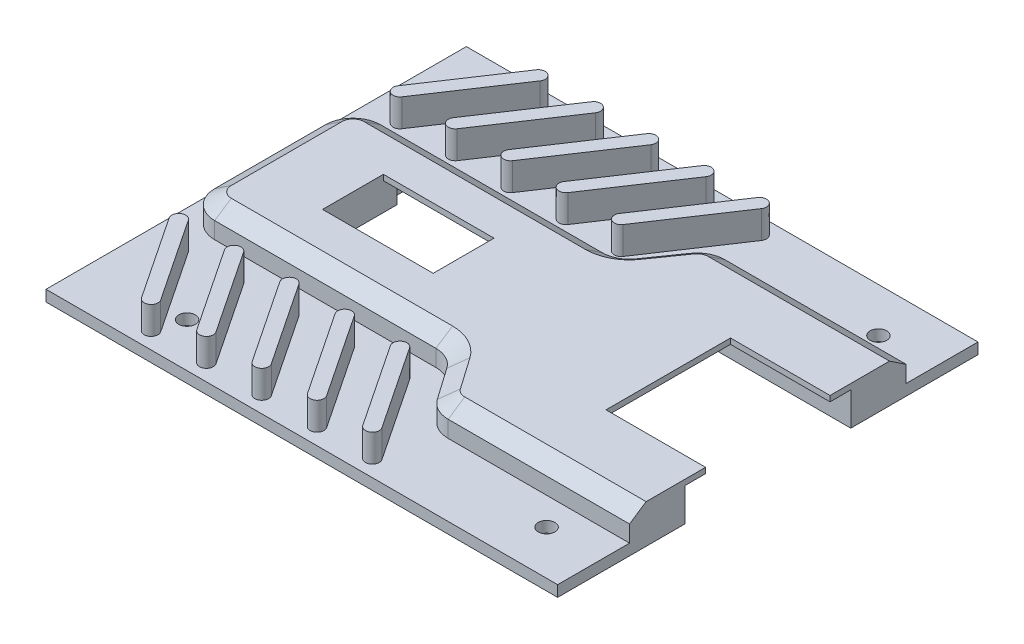
from build123d import *
from OCP.BRepFilletAPI import BRepFilletAPI_MakeChamfer

# Parameters (mm, degrees)
SKETCH1_W           = 190
SKETCH1_H           = 160
BOSS_EXTRUDE1_DEPTH = 4
BOSS_EXTRUDE2_DEPTH = 10
CHAMFER2_SIZE       = 4
CHAMFER2_SIZE2      = 6
SKETCH3_W           = 5
SKETCH3_H           = 152
SKETCH3_H_2         = 4
SKETCH3_W_2         = 185
CUT_EXTRUDE1_DEPTH  = 10
SKETCH4_W           = 40
SKETCH4_H           = 22
CUT_EXTRUDE2_DEPTH  = 20
SKETCH5_W           = 50
SKETCH5_H           = 32
CUT_EXTRUDE3_DEPTH  = 2
SKETCH6_W           = 50
SKETCH6_H           = 10
CUT_EXTRUDE5_DEPTH  = 12
SKETCH8_W           = 40
SKETCH8_H           = 10
CUT_EXTRUDE7_DEPTH  = 10
SKETCH9_W           = 40
SKETCH9_H           = 10
CUT_EXTRUDE8_DEPTH  = 10
SKETCH10_W          = 36
SKETCH10_H          = 45
CUT_EXTRUDE9_DEPTH  = 30
SKETCH11_W          = 50
SKETCH11_H          = 60
CUT_EXTRUDE10_DEPTH = 12
SKETCH12_R          = 3
CUT_EXTRUDE11_DEPTH = 10


with BuildPart() as part:
    # Sketch1 → Boss-Extrude1 (new body)
    with BuildSketch(Plane(origin=(0, 0, 0), x_dir=(1, 0, 0), z_dir=(0, 1, 0))):
        with Locations((95, 80)):
            Rectangle(SKETCH1_W, SKETCH1_H)
    extrude(amount=BOSS_EXTRUDE1_DEPTH)

    # Sketch2 → Boss-Extrude2 (add)
    with BuildSketch(Plane(origin=(0, 4, 0), x_dir=(1, 0, 0), z_dir=(0, 1, 0))):
        with BuildLine():
            Line((10, 100), (10, 60))
            ThreePointArc((10, 60), (12.928932188, 52.928932188), (20, 50))
            Line((20, 50), (100, 50))
            ThreePointArc((100, 50), (104.617486132, 48.870108332), (108.191520443, 45.735764364))
            Line((108.191520443, 45.735764364), (116.223971332, 34.264235636))
            ThreePointArc((116.223971332, 34.264235636), (119.798005643, 31.129891668), (124.415491775, 30))
            Line((124.415491775, 30), (190, 30))
            Line((190, 30), (190, 130))
            Line((190, 130), (124.415491775, 130))
            ThreePointArc((124.415491775, 130), (119.798005643, 128.870108332), (116.223971332, 125.735764364))
            Line((116.223971332, 125.735764364), (108.191520443, 114.264235636))
            ThreePointArc((108.191520443, 114.264235636), (104.617486132, 111.129891668), (100, 110))
            Line((100, 110), (68.372813246, 110))
            Line((68.372813246, 110), (20, 110))
            ThreePointArc((20, 110), (12.928932188, 107.071067812), (10, 100))
        make_face()
        with BuildLine():
            Line((14.919874264, 38.613249509), (34.919874264, 8.613249509))
            ThreePointArc((34.919874264, 8.613249509), (38.386750491, 7.919874264), (39.080125736, 11.386750491))
            Line((39.080125736, 11.386750491), (19.080125736, 41.386750491))
            ThreePointArc((19.080125736, 41.386750491), (15.613249509, 42.080125736), (14.919874264, 38.613249509))
        make_face()
        with BuildLine():
            Line((34.919874264, 38.613249509), (54.919874264, 8.613249509))
            ThreePointArc((54.919874264, 8.613249509), (58.386750491, 7.919874264), (59.080125736, 11.386750491))
            Line((59.080125736, 11.386750491), (39.080125736, 41.386750491))
            ThreePointArc((39.080125736, 41.386750491), (35.613249509, 42.080125736), (34.919874264, 38.613249509))
        make_face()
        with BuildLine():
            Line((54.919874264, 38.613249509), (74.919874264, 8.613249509))
            ThreePointArc((74.919874264, 8.613249509), (78.386750491, 7.919874264), (79.080125736, 11.386750491))
            Line((79.080125736, 11.386750491), (59.080125736, 41.386750491))
            ThreePointArc((59.080125736, 41.386750491), (55.613249509, 42.080125736), (54.919874264, 38.613249509))
        make_face()
        with BuildLine():
            Line((74.919874264, 38.613249509), (94.919874264, 8.613249509))
            ThreePointArc((94.919874264, 8.613249509), (98.386750491, 7.919874264), (99.080125736, 11.386750491))
            Line((99.080125736, 11.386750491), (79.080125736, 41.386750491))
            ThreePointArc((79.080125736, 41.386750491), (75.613249509, 42.080125736), (74.919874264, 38.613249509))
        make_face()
        with BuildLine():
            Line((94.919874264, 38.613249509), (114.919874264, 8.613249509))
            ThreePointArc((114.919874264, 8.613249509), (118.386750491, 7.919874264), (119.080125736, 11.386750491))
            Line((119.080125736, 11.386750491), (99.080125736, 41.386750491))
            ThreePointArc((99.080125736, 41.386750491), (95.613249509, 42.080125736), (94.919874264, 38.613249509))
        make_face()
        with BuildLine():
            Line((99.080125736, 118.613249509), (119.080125736, 148.613249509))
            ThreePointArc((119.080125736, 148.613249509), (118.386750491, 152.080125736), (114.919874264, 151.386750491))
            Line((114.919874264, 151.386750491), (94.919874264, 121.386750491))
            ThreePointArc((94.919874264, 121.386750491), (95.613249509, 117.919874264), (99.080125736, 118.613249509))
        make_face()
        with BuildLine():
            Line((79.080125736, 118.613249509), (99.080125736, 148.613249509))
            ThreePointArc((99.080125736, 148.613249509), (98.386750491, 152.080125736), (94.919874264, 151.386750491))
            Line((94.919874264, 151.386750491), (74.919874264, 121.386750491))
            ThreePointArc((74.919874264, 121.386750491), (75.613249509, 117.919874264), (79.080125736, 118.613249509))
        make_face()
        with BuildLine():
            Line((59.080125736, 118.613249509), (79.080125736, 148.613249509))
            ThreePointArc((79.080125736, 148.613249509), (78.386750491, 152.080125736), (74.919874264, 151.386750491))
            Line((74.919874264, 151.386750491), (54.919874264, 121.386750491))
            ThreePointArc((54.919874264, 121.386750491), (55.613249509, 117.919874264), (59.080125736, 118.613249509))
        make_face()
        with BuildLine():
            Line((39.080125736, 118.613249509), (59.080125736, 148.613249509))
            ThreePointArc((59.080125736, 148.613249509), (58.386750491, 152.080125736), (54.919874264, 151.386750491))
            Line((54.919874264, 151.386750491), (34.919874264, 121.386750491))
            ThreePointArc((34.919874264, 121.386750491), (35.613249509, 117.919874264), (39.080125736, 118.613249509))
        make_face()
        with BuildLine():
            Line((19.080125736, 118.613249509), (39.080125736, 148.613249509))
            ThreePointArc((39.080125736, 148.613249509), (38.386750491, 152.080125736), (34.919874264, 151.386750491))
            Line((34.919874264, 151.386750491), (14.919874264, 121.386750491))
            ThreePointArc((14.919874264, 121.386750491), (15.613249509, 117.919874264), (19.080125736, 118.613249509))
        make_face()
    extrude(amount=BOSS_EXTRUDE2_DEPTH)

    # Chamfer2: one chamfer whose edges measure the first distance from different faces: ONE call of the kernel's chamfer builder (chamfer() names one face for all edges)
    chamfer2_edges_1 = [part.edges().sort_by_distance(p)[0] for p in [
        (104.617486132, 14, -48.870108332),
    ]]
    chamfer2_side_1 = [part.faces().sort_by_distance(p)[0] for p in [
        (104.617486132, 9, -48.870108332),
    ]]
    chamfer2_edges_2 = [part.edges().sort_by_distance(p)[0] for p in [
        (157.207745888, 14, -130),
    ]]
    chamfer2_side_2 = [part.faces().sort_by_distance(p)[0] for p in [
        (157.207745888, 9, -130),
    ]]
    chamfer2_edges_3 = [part.edges().sort_by_distance(p)[0] for p in [
        (112.207745888, 14, -120),
    ]]
    chamfer2_side_3 = [part.faces().sort_by_distance(p)[0] for p in [
        (112.207745888, 9, -120),
    ]]
    chamfer2_edges_4 = [part.edges().sort_by_distance(p)[0] for p in [
        (60, 14, -110),
    ]]
    chamfer2_side_4 = [part.faces().sort_by_distance(p)[0] for p in [
        (60, 9, -110),
    ]]
    chamfer2_edges_5 = [part.edges().sort_by_distance(p)[0] for p in [
        (10, 14, -80),
    ]]
    chamfer2_side_5 = [part.faces().sort_by_distance(p)[0] for p in [
        (10, 9, -80),
    ]]
    chamfer2_edges_6 = [part.edges().sort_by_distance(p)[0] for p in [
        (112.207745888, 14, -40),
    ]]
    chamfer2_side_6 = [part.faces().sort_by_distance(p)[0] for p in [
        (112.207745888, 9, -40),
    ]]
    chamfer2_edges_7 = [part.edges().sort_by_distance(p)[0] for p in [
        (119.798005643, 14, -31.129891668),
    ]]
    chamfer2_side_7 = [part.faces().sort_by_distance(p)[0] for p in [
        (119.798005643, 9, -31.129891668),
    ]]
    chamfer2_edges_8 = [part.edges().sort_by_distance(p)[0] for p in [
        (157.207745888, 14, -30),
    ]]
    chamfer2_side_8 = [part.faces().sort_by_distance(p)[0] for p in [
        (157.207745888, 9, -30),
    ]]
    chamfer2_edges_9 = [part.edges().sort_by_distance(p)[0] for p in [
        (119.798005643, 14, -128.870108332),
    ]]
    chamfer2_side_9 = [part.faces().sort_by_distance(p)[0] for p in [
        (119.798005643, 9, -128.870108332),
    ]]
    chamfer2_edges_10 = [part.edges().sort_by_distance(p)[0] for p in [
        (104.617486132, 14, -111.129891668),
    ]]
    chamfer2_side_10 = [part.faces().sort_by_distance(p)[0] for p in [
        (104.617486132, 9, -111.129891668),
    ]]
    chamfer2_edges_11 = [part.edges().sort_by_distance(p)[0] for p in [
        (12.928932188, 14, -107.071067812),
    ]]
    chamfer2_side_11 = [part.faces().sort_by_distance(p)[0] for p in [
        (12.928932188, 9, -107.071067812),
    ]]
    chamfer2_edges_12 = [part.edges().sort_by_distance(p)[0] for p in [
        (12.928932188, 14, -52.928932188),
    ]]
    chamfer2_side_12 = [part.faces().sort_by_distance(p)[0] for p in [
        (12.928932188, 9, -52.928932188),
    ]]
    chamfer2_edges_13 = [part.edges().sort_by_distance(p)[0] for p in [
        (60, 14, -50),
    ]]
    chamfer2_side_13 = [part.faces().sort_by_distance(p)[0] for p in [
        (60, 9, -50),
    ]]
    chamfer2 = BRepFilletAPI_MakeChamfer(part.part.solid().wrapped)
    for e in chamfer2_edges_1:
        chamfer2.Add(CHAMFER2_SIZE, CHAMFER2_SIZE2, e.wrapped, chamfer2_side_1[0].wrapped)  # the first distance lies on this face
    for e in chamfer2_edges_2:
        chamfer2.Add(CHAMFER2_SIZE, CHAMFER2_SIZE2, e.wrapped, chamfer2_side_2[0].wrapped)  # the first distance lies on this face
    for e in chamfer2_edges_3:
        chamfer2.Add(CHAMFER2_SIZE, CHAMFER2_SIZE2, e.wrapped, chamfer2_side_3[0].wrapped)  # the first distance lies on this face
    for e in chamfer2_edges_4:
        chamfer2.Add(CHAMFER2_SIZE, CHAMFER2_SIZE2, e.wrapped, chamfer2_side_4[0].wrapped)  # the first distance lies on this face
    for e in chamfer2_edges_5:
        chamfer2.Add(CHAMFER2_SIZE, CHAMFER2_SIZE2, e.wrapped, chamfer2_side_5[0].wrapped)  # the first distance lies on this face
    for e in chamfer2_edges_6:
        chamfer2.Add(CHAMFER2_SIZE, CHAMFER2_SIZE2, e.wrapped, chamfer2_side_6[0].wrapped)  # the first distance lies on this face
    for e in chamfer2_edges_7:
        chamfer2.Add(CHAMFER2_SIZE, CHAMFER2_SIZE2, e.wrapped, chamfer2_side_7[0].wrapped)  # the first distance lies on this face
    for e in chamfer2_edges_8:
        chamfer2.Add(CHAMFER2_SIZE, CHAMFER2_SIZE2, e.wrapped, chamfer2_side_8[0].wrapped)  # the first distance lies on this face
    for e in chamfer2_edges_9:
        chamfer2.Add(CHAMFER2_SIZE, CHAMFER2_SIZE2, e.wrapped, chamfer2_side_9[0].wrapped)  # the first distance lies on this face
    for e in chamfer2_edges_10:
        chamfer2.Add(CHAMFER2_SIZE, CHAMFER2_SIZE2, e.wrapped, chamfer2_side_10[0].wrapped)  # the first distance lies on this face
    for e in chamfer2_edges_11:
        chamfer2.Add(CHAMFER2_SIZE, CHAMFER2_SIZE2, e.wrapped, chamfer2_side_11[0].wrapped)  # the first distance lies on this face
    for e in chamfer2_edges_12:
        chamfer2.Add(CHAMFER2_SIZE, CHAMFER2_SIZE2, e.wrapped, chamfer2_side_12[0].wrapped)  # the first distance lies on this face
    for e in chamfer2_edges_13:
        chamfer2.Add(CHAMFER2_SIZE, CHAMFER2_SIZE2, e.wrapped, chamfer2_side_13[0].wrapped)  # the first distance lies on this face
    add(Compound.cast(chamfer2.Shape()), mode=Mode.REPLACE)

    # Sketch3 → Cut-Extrude1 (cut)
    with BuildSketch(Plane(origin=(0, 4, 0), x_dir=(1, 0, 0), z_dir=(0, 1, 0))):
        Polygon((0, 0), (190, 0), (190, 4), (5, 4), (0, 4), align=None)
        with Locations((2.5, 80)):
            Rectangle(SKETCH3_W, SKETCH3_H)
        with Locations((2.5, 158)):
            Rectangle(SKETCH3_W, SKETCH3_H_2)
        with Locations((97.5, 158)):
            Rectangle(SKETCH3_W_2, SKETCH3_H_2)
    extrude(amount=-CUT_EXTRUDE1_DEPTH, mode=Mode.SUBTRACT)

    # Sketch4 → Cut-Extrude2 (cut)
    with BuildSketch(Plane(origin=(0, 14, 0), x_dir=(1, 0, 0), z_dir=(0, 1, 0))):
        with Locations((60, 80)):
            Rectangle(SKETCH4_W, SKETCH4_H)
    extrude(amount=-CUT_EXTRUDE2_DEPTH, mode=Mode.SUBTRACT)

    # Sketch5 → Cut-Extrude3 (cut)
    with BuildSketch(Plane.XZ):
        with Locations((60, -80)):
            Rectangle(SKETCH5_W, SKETCH5_H)
    extrude(amount=-CUT_EXTRUDE3_DEPTH, mode=Mode.SUBTRACT)

    # Sketch6 → Cut-Extrude5 (cut)
    with BuildSketch(Plane(origin=(0, 0, 0), x_dir=(-1, 0, 0), z_dir=(0, -1, 0))):
        with Locations((-60, 101)):
            Rectangle(SKETCH6_W, SKETCH6_H)
        with Locations((-60, 59)):
            Rectangle(SKETCH6_W, SKETCH6_H)
    extrude(amount=-CUT_EXTRUDE5_DEPTH, mode=Mode.SUBTRACT)

    # Sketch8 → Cut-Extrude7 (cut)
    with BuildSketch(Plane.XY.offset(-91)):
        with Locations((60, 7)):
            Rectangle(SKETCH8_W, SKETCH8_H)
    extrude(amount=-CUT_EXTRUDE7_DEPTH, mode=Mode.SUBTRACT)

    # Sketch9 → Cut-Extrude8 (cut)
    with BuildSketch(Plane(origin=(0, 0, -69), x_dir=(-1, 0, 0), z_dir=(0, 0, -1))):
        with Locations((-60, 7)):
            Rectangle(SKETCH9_W, SKETCH9_H)
    extrude(amount=-CUT_EXTRUDE8_DEPTH, mode=Mode.SUBTRACT)

    # Sketch10 → Cut-Extrude9 (cut)
    with BuildSketch(Plane(origin=(0, 14, 0), x_dir=(1, 0, 0), z_dir=(0, 1, 0))):
        with Locations((172, 80)):
            Rectangle(SKETCH10_W, SKETCH10_H)
    extrude(amount=-CUT_EXTRUDE9_DEPTH, mode=Mode.SUBTRACT)

    # Sketch11 → Cut-Extrude10 (cut)
    with BuildSketch(Plane.XZ):
        with Locations((165, -80)):
            Rectangle(SKETCH11_W, SKETCH11_H)
    extrude(amount=-CUT_EXTRUDE10_DEPTH, mode=Mode.SUBTRACT)

    # Sketch12 → Cut-Extrude11 (cut)
    with BuildSketch(Plane(origin=(0, 4, 0), x_dir=(1, 0, 0), z_dir=(0, 1, 0))):
        with Locations(Location((40, 140, 0), (0, 0, 270))):
            Circle(SKETCH12_R)
        with Locations(Location((170, 140, 0), (0, 0, 270))):
            Circle(SKETCH12_R)
        with Locations(Location((40, 20, 0), (0, 0, 90))):
            Circle(SKETCH12_R)
        with Locations(Location((170, 20, 0), (0, 0, 90))):
            Circle(SKETCH12_R)
    extrude(amount=-CUT_EXTRUDE11_DEPTH, mode=Mode.SUBTRACT)


solid = part.part
